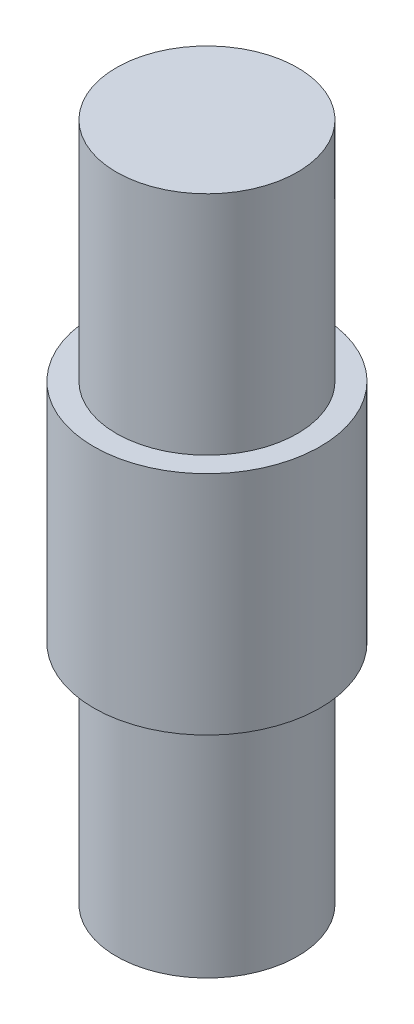
from build123d import *

# Parameters (mm, degrees)
SKETCH_1_R      = 5
EXTRUDE_4_DEPTH = 10
SKETCH_4_R      = 4
EXTRUDE_5_DEPTH = 10
EXTRUDE_START   = 10
SKETCH_5_R      = 4
EXTRUDE_6_DEPTH = 10


with BuildPart() as part:
    # 草图1 → 凸台-拉伸4 (new body)
    with BuildSketch(Plane(origin=(0, 0, 0), x_dir=(1, 0, 0), z_dir=(0, 1, 0))):
        with Locations(Location((0, 0, 0), (0, 0, 270))):
            Circle(SKETCH_1_R)
    extrude(amount=EXTRUDE_4_DEPTH)

    # 草图4 → 凸台-拉伸5 (add)
    with BuildSketch(Plane(origin=(0, 10, 0), x_dir=(1, 0, 0), z_dir=(0, 1, 0))):
        with Locations(Location((0, 0, 0), (0, 0, 270))):
            Circle(SKETCH_4_R)
    extrude(amount=EXTRUDE_5_DEPTH)

    # 草图5 → 凸台-拉伸6 (add)
    with BuildSketch(Plane.XZ.offset(EXTRUDE_START)):
        with Locations(Location((0, 0, 0), (0, 0, 90))):
            Circle(SKETCH_5_R)
    extrude(amount=-EXTRUDE_6_DEPTH)


solid = part.part
